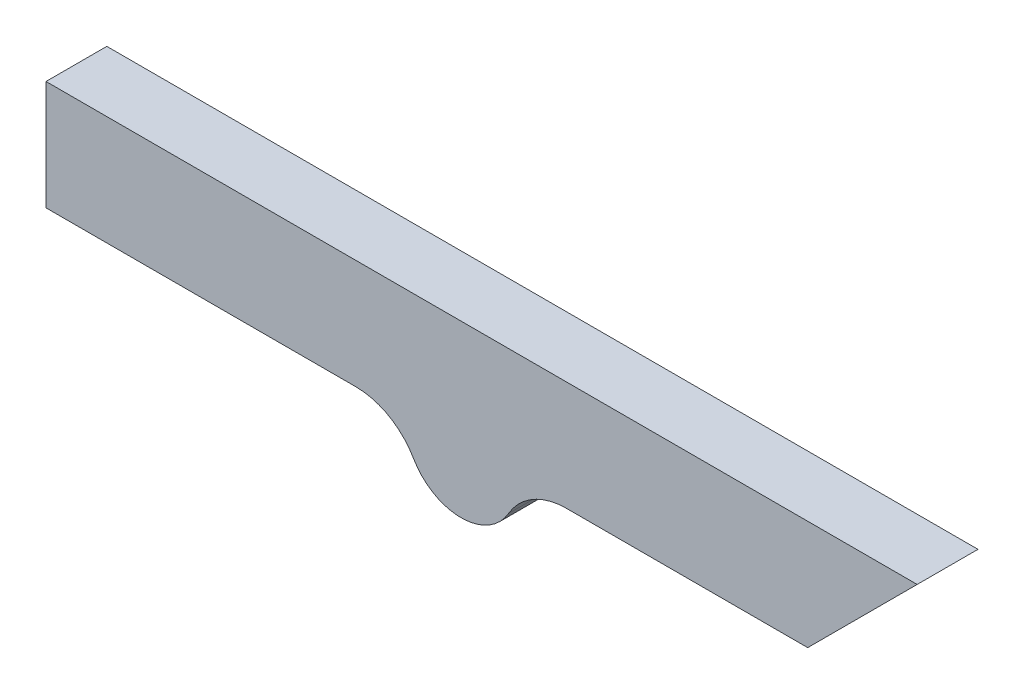
from build123d import *

# Parameters (mm, degrees)
SHAPE_DEPTH = 1


with BuildPart() as part:
    # Sketch1 → Shape (new body)
    with BuildSketch(Plane.XY):
        with BuildLine():
            Line((17.307050808, 11.375), (21.274494937, 11.375))
            Line((21.274494937, 11.375), (23.074494937, 13.175))
            Line((23.074494937, 13.175), (8.75, 13.175))
            Line((8.75, 13.175), (8.75, 11.375))
            Line((8.75, 11.375), (13.842949192, 11.375))
            ThreePointArc((13.842949192, 11.375), (14.392949192, 11.227627944), (14.795577137, 10.825))
            ThreePointArc((14.795577137, 10.825), (15.575, 10.375), (16.354422863, 10.825))
            ThreePointArc((16.354422863, 10.825), (16.757050808, 11.227627944), (17.307050808, 11.375))
        make_face()
    extrude(amount=SHAPE_DEPTH)


solid = part.part
